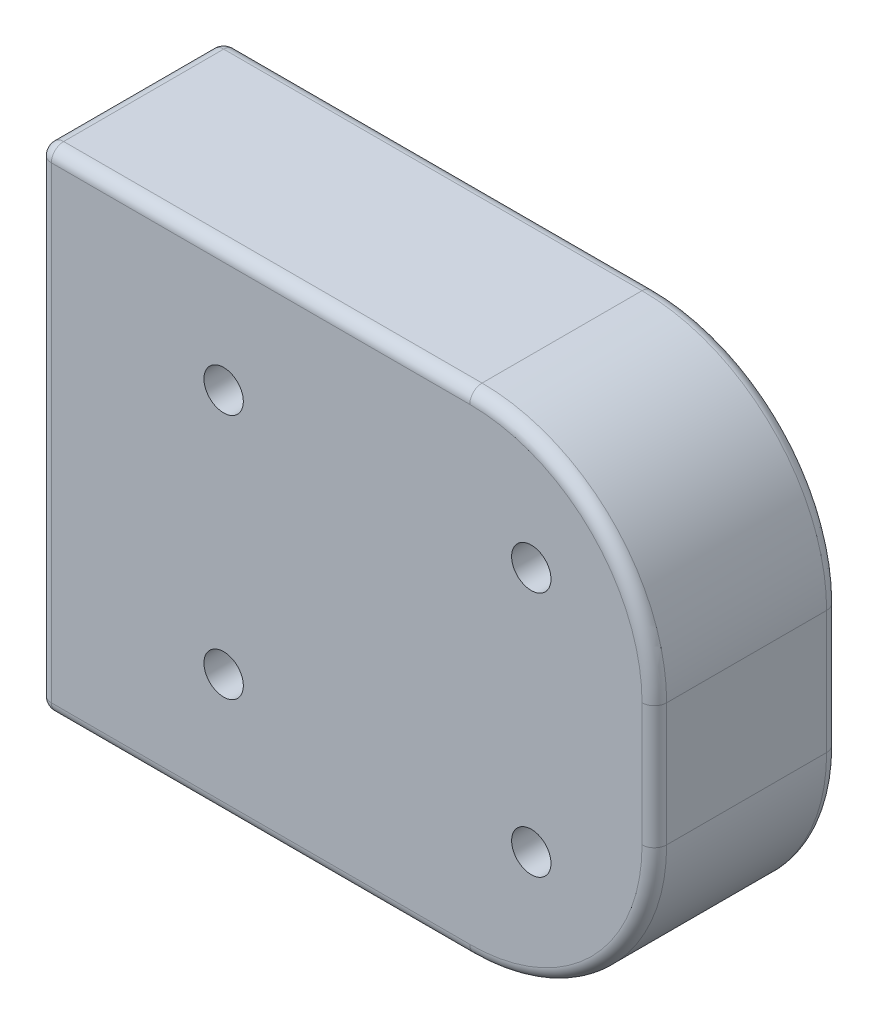
from build123d import *

# Parameters (mm, degrees)
SKETCH_1_W          = 50
SKETCH_1_H          = 40
EXTRUDE_1_DEPTH     = 15
SKETCH_2_R          = 1.6
CUT_EXTRUDE_1_DEPTH = 36.355339059
FILLET_1_R          = 15
FILLET_2_R          = 1
FILLET_3_R          = 1


with BuildPart() as part:
    # 草图1 → 凸台-拉伸1 (new body)
    with BuildSketch(Plane.XY):
        Rectangle(SKETCH_1_W, SKETCH_1_H)
    extrude(amount=EXTRUDE_1_DEPTH)

    # 草图2 → 切除-拉伸1 (cut, through all)
    with BuildSketch(Plane.XY.offset(15)):
        with Locations((-10, 10)):
            Circle(SKETCH_2_R)
        with Locations(Location((15, 10, 0), (0, 0, 180))):
            Circle(SKETCH_2_R)
        with Locations((15, -10)):
            Circle(SKETCH_2_R)
        with Locations(Location((-10, -10, 0), (0, 0, 180))):
            Circle(SKETCH_2_R)
    extrude(amount=-CUT_EXTRUDE_1_DEPTH, mode=Mode.SUBTRACT)

    # 圆角1
    fillet_1_edges = [part.edges().sort_by_distance(p)[0] for p in [
        (25, -20, 7.5),
        (25, 20, 7.5),
    ]]
    fillet(fillet_1_edges, radius=FILLET_1_R)

    # 圆角2
    fillet_2_edges = [part.edges().sort_by_distance(p)[0] for p in [
        (-25, -20, 7.5),
        (-25, 20, 7.5),
    ]]
    fillet(fillet_2_edges, radius=FILLET_2_R)

    # 圆角3
    fillet_3_edges = [part.edges().sort_by_distance(p)[0] for p in [
        (25, 0, 0),
        (25, 0, 15),
        (-7, 20, 0),
        (20.606601718, 15.606601718, 0),
        (20.606601718, -15.606601718, 0),
        (-7, 20, 15),
        (20.606601718, 15.606601718, 15),
        (20.606601718, -15.606601718, 15),
        (-7, -20, 0),
        (-7, -20, 15),
        (-25, 0, 0),
        (-24.707106781, 19.707106781, 0),
        (-24.707106781, -19.707106781, 0),
        (-25, 0, 15),
        (-24.707106781, 19.707106781, 15),
        (-24.707106781, -19.707106781, 15),
    ]]
    fillet(fillet_3_edges, radius=FILLET_3_R)


solid = part.part
